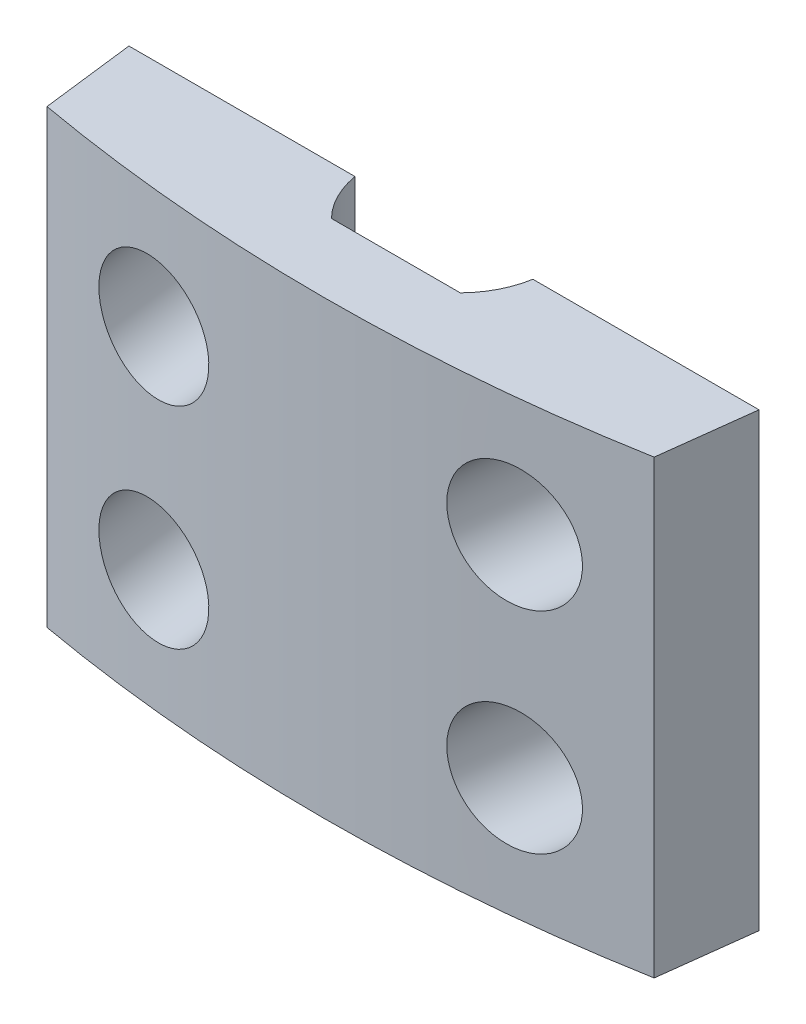
from build123d import *

# Parameters (mm, degrees)
EXTRUDE_1_DEPTH     = 15
SKETCH_2_R          = 2
CUT_EXTRUDE_1_DEPTH = 62
SKETCH_4_R          = 2
CUT_EXTRUDE_2_DEPTH = 62


with BuildPart() as part:
    # 草图1 → 凸台-拉伸1 (new body)
    with BuildSketch(Plane(origin=(0, 0, 0), x_dir=(1, 0, 0), z_dir=(0, 1, 0))):
        with BuildLine():
            Line((-2.142428529, 50.9), (2.142428529, 50.9))
            ThreePointArc((2.142428529, 50.9), (2.672598452, 51.637202321), (2.957914583, 52.49925923))
            Line((2.957914583, 52.49925923), (10.476137794, 52.49925923))
            Line((10.476137794, 52.49925923), (10.094743956, 49.393055687))
            ThreePointArc((10.094743956, 49.393055687), (0, 48.5), (-10.094743956, 49.393055687))
            Line((-10.094743956, 49.393055687), (-10.476137794, 52.49925923))
            Line((-10.476137794, 52.49925923), (-2.957914583, 52.49925923))
            ThreePointArc((-2.957914583, 52.49925923), (-2.672598452, 51.637202321), (-2.142428529, 50.9))
        make_face()
    extrude(amount=EXTRUDE_1_DEPTH)

    # 草图2 → 切除-拉伸1 (cut)
    with BuildSketch(Plane(origin=(-12.821860467, 0, -104.425673493), x_dir=(0.9925461516413212, 0, -0.12186934340515458), z_dir=(0.12186934340515458, 0, 0.9925461516413212))):
        with Locations(Location((0.000150401, 4, 0), (0, 0, 180))):
            Circle(SKETCH_2_R)
        with Locations(Location((0.000150401, 11, 0), (0, 0, 180))):
            Circle(SKETCH_2_R)
    extrude(amount=CUT_EXTRUDE_1_DEPTH, mode=Mode.SUBTRACT)

    # 草图4 → 切除-拉伸2 (cut)
    with BuildSketch(Plane(origin=(12.821860467, 0, -104.425673493), x_dir=(-0.992546151641322, 0, -0.12186934340514766), z_dir=(0.12186934340514766, 0, -0.992546151641322))):
        with Locations((0.000150401, 11)):
            Circle(SKETCH_4_R)
        with Locations((0.000150401, 4)):
            Circle(SKETCH_4_R)
    extrude(amount=-CUT_EXTRUDE_2_DEPTH, mode=Mode.SUBTRACT)


solid = part.part
